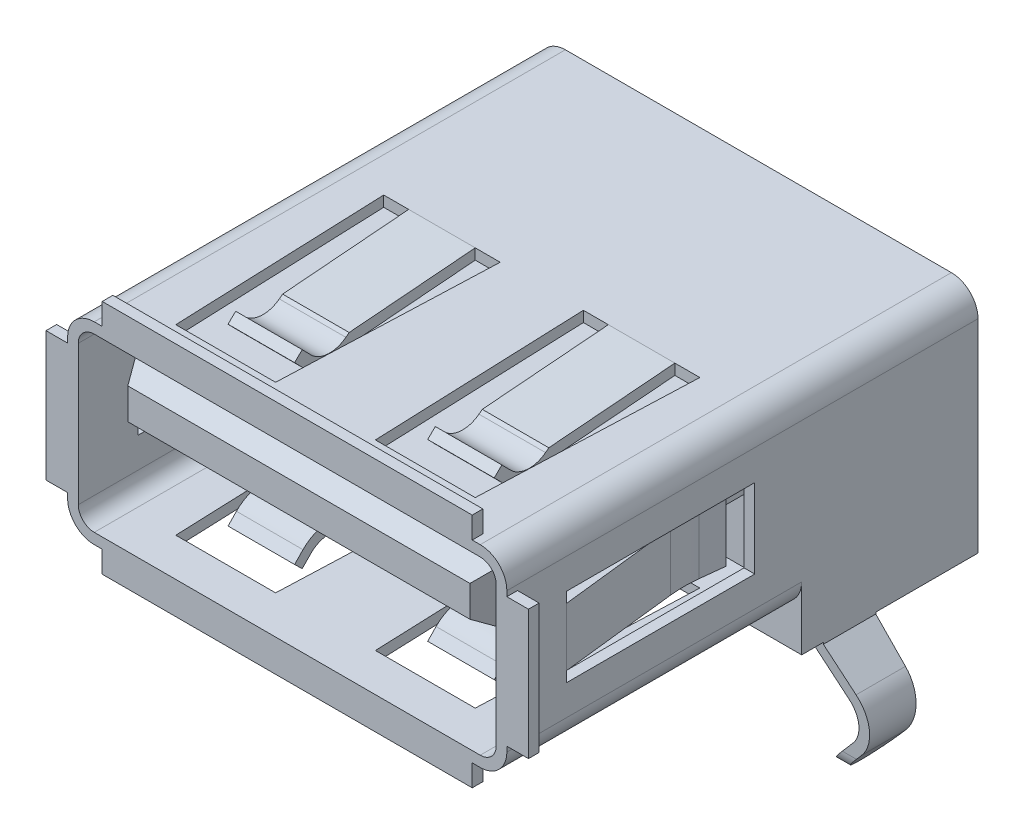
from build123d import *
from OCP.BRepFilletAPI import BRepFilletAPI_MakeChamfer

# Parameters (mm, degrees)
SKETCH1_W                       = 13.2
SKETCH1_H                       = 14.16
BASE_DEPTH                      = 5.8
SKETCH3_W                       = 11.12
SKETCH3_H                       = 0.65
SKETCH3_W_2                     = 0.65
SKETCH3_H_2                     = 3.89
FRONT_TABS_DEPTH                = 0.32
CORNER_FILLETS_R                = 0.8
CONTACT_AREA_CUTOUT_DEPTH       = 8.85
BACK_STEP_DEPTH                 = 5.3
SKETCH19_W                      = 2.4
SKETCH19_H                      = 3.1
BOTTOM_STEP_DEPTH               = 1.1
GROUND_TAIL_DEPTH               = 0.79
GROUND_TAIL_SHAPE_DEPTH         = 8
TOP_BOTTOM_FLANGE_CUTOUT_DEPTH  = 15.716534918
TOP_BOTTOM_FLANGE_DEPTH         = 1
TOP_BOTTOM_FLANGE_PATTERN_COUNT = 2
TOP_BOTTOM_FLANGE_PATTERN_PITCH = 6
SKETCH14_W                      = 5.65
SKETCH14_H                      = 2.38
SIDE_FLANGE_CUTOUT_DEPTH        = 18.377540102
SIDE_FLANGE_DEPTH               = 0.875
SKETCH16_W                      = 11.15
SKETCH16_H                      = 1.8
CONTACT_GUIDE_DEPTH             = 8.5
CONTACT_GUIDE_LEAD_IN_SIZE      = 0.75
CONTACT_GUIDE_LEAD_IN_SIZE2     = 0.433012702
CONTACT_1_DEPTH                 = 0.33
CONTACT_PATTERN2_COUNT          = 2
CONTACT_PATTERN2_PITCH          = 2.5
CONTACT_PATTERN3_COUNT          = 2
CONTACT_PATTERN3_PITCH          = 4.5
CONTACT_PATTERN4_COUNT          = 2
CONTACT_PATTERN4_PITCH          = 7
SKETCH20_W                      = 0.68
SKETCH20_H                      = 0.31
TAILS_DEPTH                     = 3.3


with BuildPart() as part:
    # Sketch1 → Base (new body)
    with BuildSketch(Plane(origin=(0, 0, 0), x_dir=(1, 0, 0), z_dir=(0, 1, 0))):
        Rectangle(SKETCH1_W, SKETCH1_H)
    extrude(amount=BASE_DEPTH)

    # Sketch3 → Front Tabs (add)
    with BuildSketch(Plane.XY.offset(7.08)):
        with Locations((0, 6.125)):
            Rectangle(SKETCH3_W, SKETCH3_H)
        with Locations((6.925, 2.9)):
            Rectangle(SKETCH3_W_2, SKETCH3_H_2)
        with Locations((0, -0.325)):
            Rectangle(SKETCH3_W, SKETCH3_H)
        with Locations((-6.925, 2.9)):
            Rectangle(SKETCH3_W_2, SKETCH3_H_2)
    extrude(amount=-FRONT_TABS_DEPTH)

    # Corner Fillets
    corner_fillets_edges = [part.edges().sort_by_distance(p)[0] for p in [
        (-6.6, 5.8, 0),
        (-6.6, 0, 0),
        (6.6, 0, 0),
        (6.6, 5.8, 0),
    ]]
    fillet(corner_fillets_edges, radius=CORNER_FILLETS_R)

    # Sketch8 → Contact Area Cutout (cut)
    with BuildSketch(Plane.XY.offset(7.08)):
        with BuildLine():
            Line((-6.28, 5), (-6.28, 0.8))
            ThreePointArc((-6.28, 0.8), (-6.139411255, 0.460588745), (-5.8, 0.32))
            Line((-5.8, 0.32), (5.8, 0.32))
            ThreePointArc((5.8, 0.32), (6.139411255, 0.460588745), (6.28, 0.8))
            Line((6.28, 0.8), (6.28, 5))
            ThreePointArc((6.28, 5), (6.139411255, 5.339411255), (5.8, 5.48))
            Line((5.8, 5.48), (-5.8, 5.48))
            ThreePointArc((-5.8, 5.48), (-6.139411255, 5.339411255), (-6.28, 5))
        make_face()
    extrude(amount=-CONTACT_AREA_CUTOUT_DEPTH, mode=Mode.SUBTRACT)

    # Sketch18 → Back Step (add)
    with BuildSketch(Plane(origin=(0, 0, -7.08), x_dir=(-1, 0, 0), z_dir=(0, 0, -1))):
        with BuildLine():
            Line((-6.6, 0.8), (-6.6, -1.1))
            Line((-6.6, -1.1), (6.6, -1.1))
            Line((6.6, -1.1), (6.6, 0.8))
            ThreePointArc((6.6, 0.8), (6.365685425, 0.234314575), (5.8, 0))
            Line((5.8, 0), (-5.8, 0))
            ThreePointArc((-5.8, 0), (-6.365685425, 0.234314575), (-6.6, 0.8))
        make_face()
    extrude(amount=-BACK_STEP_DEPTH)

    # Sketch19 → Bottom Step (add)
    with BuildSketch(Plane.XZ):
        with Locations((0, -0.23)):
            Rectangle(SKETCH19_W, SKETCH19_H)
    extrude(amount=BOTTOM_STEP_DEPTH)

    # Sketch10 → Ground Tail (add, symmetric)
    with BuildSketch(Plane.XY.offset(-3.22)):
        with BuildLine():
            Line((6.6, -1.15), (6.6, -1.1))
            Line((6.6, -1.1), (6.28, -1.1))
            Line((6.28, -1.1), (6.28, -1.28965545))
            Line((6.28, -1.28965545), (7.319978774, -2.254199461))
            ThreePointArc((7.319978774, -2.254199461), (7.578832958, -2.806464642), (7.380555001, -3.383255914))
            Line((7.380555001, -3.383255914), (6.505, -4.390006458))
            Line((6.505, -4.390006458), (6.746459546, -4.6))
            Line((6.746459546, -4.6), (7.622014547, -3.593249456))
            ThreePointArc((7.622014547, -3.593249456), (7.898373383, -2.789320634), (7.537583701, -2.019576155))
            Line((7.537583701, -2.019576155), (6.6, -1.15))
        make_face()
        with BuildLine():
            Line((-6.746459546, -4.6), (-6.505, -4.390006458))
            Line((-6.505, -4.390006458), (-7.380555001, -3.383255914))
            ThreePointArc((-7.380555001, -3.383255914), (-7.578832958, -2.806464642), (-7.319978774, -2.254199461))
            Line((-7.319978774, -2.254199461), (-6.28, -1.28965545))
            Line((-6.28, -1.28965545), (-6.28, -1.1))
            Line((-6.28, -1.1), (-6.6, -1.1))
            Line((-6.6, -1.1), (-6.6, -1.15))
            Line((-6.6, -1.15), (-7.537583701, -2.019576155))
            ThreePointArc((-7.537583701, -2.019576155), (-7.898373383, -2.789320634), (-7.622014547, -3.593249456))
            Line((-7.622014547, -3.593249456), (-6.746459546, -4.6))
        make_face()
    extrude(amount=GROUND_TAIL_DEPTH, both=True)

    # Sketch11 → Ground Tail Shape (cut, symmetric)
    with BuildSketch(Plane(origin=(0, 0, 0), x_dir=(0, 0, -1), z_dir=(1, 0, 0))):
        with BuildLine():
            Line((2.43, -1.1), (2.570893678, -3.784073205))
            ThreePointArc((2.570893678, -3.784073205), (2.772589441, -4.221512239), (3.22, -4.4))
            ThreePointArc((3.22, -4.4), (3.667410559, -4.221512239), (3.869106322, -3.784073205))
            Line((3.869106322, -3.784073205), (4.01, -1.1))
            Line((4.01, -1.1), (4.01, -4.7))
            Line((4.01, -4.7), (2.43, -4.7))
            Line((2.43, -4.7), (2.43, -1.1))
        make_face()
    extrude(amount=GROUND_TAIL_SHAPE_DEPTH, both=True, mode=Mode.SUBTRACT)

    # Sketch12 → Top/Bottom Flange Cutout (cut, through all)
    with BuildSketch(Plane(origin=(0, 5.8, 0), x_dir=(-1, 0, 0), z_dir=(0, 1, 0))):
        Polygon((4.5, 5.93), (4.75, -0.57), (1.25, -0.57), (1.5, 5.93), align=None)
        Polygon((-4.75, -0.57), (-1.25, -0.57), (-1.5, 5.93), (-4.5, 5.93), align=None)
    extrude(amount=-TOP_BOTTOM_FLANGE_CUTOUT_DEPTH, mode=Mode.SUBTRACT)

    # Sketch13 → Top/Bottom Flange (add, symmetric)
    with BuildSketch(Plane(origin=(-3, 0, 0), x_dir=(0, 0, -1), z_dir=(1, 0, 0))):
        with BuildLine():
            Line((0.57, 5.8), (-3.219077045, 5.491150763))
            Line((-3.219077045, 5.491150763), (-3.318256378, 5.415113674))
            ThreePointArc((-3.318256378, 5.415113674), (-3.86239675, 5.252061648), (-4.377598873, 5.491313566))
            Line((-4.377598873, 5.491313566), (-4.63, 5.75))
            Line((-4.63, 5.75), (-4.859039549, 5.526525427))
            Line((-4.859039549, 5.526525427), (-4.606638422, 5.267838993))
            ThreePointArc((-4.606638422, 5.267838993), (-3.88535545, 4.932886308), (-3.12355893, 5.161159144))
            Line((-3.12355893, 5.161159144), (-3.099161332, 5.179863871))
            Line((-3.099161332, 5.179863871), (0.57, 5.478938728))
            Line((0.57, 5.478938728), (0.57, 5.8))
        make_face()
        with BuildLine():
            Line((0.57, 0), (0.57, 0.321061272))
            Line((0.57, 0.321061272), (-3.099161332, 0.620136129))
            Line((-3.099161332, 0.620136129), (-3.12355893, 0.638840856))
            ThreePointArc((-3.12355893, 0.638840856), (-3.88535545, 0.867113692), (-4.606638422, 0.532161007))
            Line((-4.606638422, 0.532161007), (-4.859039549, 0.273474573))
            Line((-4.859039549, 0.273474573), (-4.63, 0.05))
            Line((-4.63, 0.05), (-4.377598873, 0.308686434))
            ThreePointArc((-4.377598873, 0.308686434), (-3.86239675, 0.547938352), (-3.318256378, 0.384886326))
            Line((-3.318256378, 0.384886326), (-3.219077045, 0.308849237))
            Line((-3.219077045, 0.308849237), (0.57, 0))
        make_face()
    top_bottom_flange = extrude(amount=TOP_BOTTOM_FLANGE_DEPTH, both=True)

    # Top/Bottom Flange Pattern: Top/Bottom Flange ×2
    with Locations(*[(i * TOP_BOTTOM_FLANGE_PATTERN_PITCH, 0, 0) for i in range(1, TOP_BOTTOM_FLANGE_PATTERN_COUNT)]):
        add(top_bottom_flange)

    # Sketch14 → Side Flange Cutout (cut, through all)
    with BuildSketch(Plane(origin=(6.6, 0, 0), x_dir=(0, 0, -1), z_dir=(1, 0, 0))):
        with Locations((-2.455, 2.9)):
            Rectangle(SKETCH14_W, SKETCH14_H)
    extrude(amount=-SIDE_FLANGE_CUTOUT_DEPTH, mode=Mode.SUBTRACT)

    # Sketch15 → Side Flange (add, symmetric)
    with BuildSketch(Plane(origin=(0, 2.9, 0), x_dir=(-1, 0, 0), z_dir=(0, 1, 0))):
        with BuildLine():
            Line((6.6, 5.28), (6.199012428, 1.753694006))
            ThreePointArc((6.199012428, 1.753694006), (6.175000079, 1.330770202), (6.198838699, 0.90783657))
            Line((6.198838699, 0.90783657), (6.281300503, 0.18))
            Line((6.281300503, 0.18), (5.963334739, 0.143975387))
            Line((5.963334739, 0.143975387), (5.880872935, 0.871811958))
            ThreePointArc((5.880872935, 0.871811958), (5.855000086, 1.330835926), (5.881061488, 1.789849227))
            Line((5.881061488, 1.789849227), (6.28204906, 5.316155222))
            Line((6.28204906, 5.316155222), (6.6, 5.28))
        make_face()
        with BuildLine():
            Line((-5.963334739, 0.143975387), (-6.281300503, 0.18))
            Line((-6.281300503, 0.18), (-6.198838699, 0.90783657))
            ThreePointArc((-6.198838699, 0.90783657), (-6.175000079, 1.330770202), (-6.199012428, 1.753694006))
            Line((-6.199012428, 1.753694006), (-6.6, 5.28))
            Line((-6.6, 5.28), (-6.28204906, 5.316155222))
            Line((-6.28204906, 5.316155222), (-5.881061488, 1.789849227))
            ThreePointArc((-5.881061488, 1.789849227), (-5.855000086, 1.330835926), (-5.880872935, 0.871811958))
            Line((-5.880872935, 0.871811958), (-5.963334739, 0.143975387))
        make_face()
    extrude(amount=SIDE_FLANGE_DEPTH, both=True)

    # Sketch16 → Contact Guide (add)
    with BuildSketch(Plane.XY.offset(-1.77)):
        with Locations((0, 3.82)):
            Rectangle(SKETCH16_W, SKETCH16_H)
    extrude(amount=CONTACT_GUIDE_DEPTH)

    # Contact Guide Lead-in: one chamfer whose edges measure the first distance from different faces: ONE call of the kernel's chamfer builder (chamfer() names one face for all edges)
    contact_guide_lead_in_edges_1 = [part.edges().sort_by_distance(p)[0] for p in [
        (5.575, 3.82, 6.73),
    ]]
    contact_guide_lead_in_side_1 = [part.faces().sort_by_distance(p)[0] for p in [
        (5.575, 3.82, 2.48),
    ]]
    contact_guide_lead_in_edges_2 = [part.edges().sort_by_distance(p)[0] for p in [
        (0, 4.72, 6.73),
    ]]
    contact_guide_lead_in_side_2 = [part.faces().sort_by_distance(p)[0] for p in [
        (0, 4.72, 2.48),
    ]]
    contact_guide_lead_in_edges_3 = [part.edges().sort_by_distance(p)[0] for p in [
        (-5.575, 3.82, 6.73),
    ]]
    contact_guide_lead_in_side_3 = [part.faces().sort_by_distance(p)[0] for p in [
        (-5.575, 3.82, 2.48),
    ]]
    contact_guide_lead_in_edges_4 = [part.edges().sort_by_distance(p)[0] for p in [
        (0, 2.92, 6.73),
    ]]
    contact_guide_lead_in_side_4 = [part.faces().sort_by_distance(p)[0] for p in [
        (0, 2.92, 2.48),
    ]]
    contact_guide_lead_in = BRepFilletAPI_MakeChamfer(part.part.solid().wrapped)
    for e in contact_guide_lead_in_edges_1:
        contact_guide_lead_in.Add(CONTACT_GUIDE_LEAD_IN_SIZE, CONTACT_GUIDE_LEAD_IN_SIZE2, e.wrapped, contact_guide_lead_in_side_1[0].wrapped)  # the first distance lies on this face
    for e in contact_guide_lead_in_edges_2:
        contact_guide_lead_in.Add(CONTACT_GUIDE_LEAD_IN_SIZE, CONTACT_GUIDE_LEAD_IN_SIZE2, e.wrapped, contact_guide_lead_in_side_2[0].wrapped)  # the first distance lies on this face
    for e in contact_guide_lead_in_edges_3:
        contact_guide_lead_in.Add(CONTACT_GUIDE_LEAD_IN_SIZE, CONTACT_GUIDE_LEAD_IN_SIZE2, e.wrapped, contact_guide_lead_in_side_3[0].wrapped)  # the first distance lies on this face
    for e in contact_guide_lead_in_edges_4:
        contact_guide_lead_in.Add(CONTACT_GUIDE_LEAD_IN_SIZE, CONTACT_GUIDE_LEAD_IN_SIZE2, e.wrapped, contact_guide_lead_in_side_4[0].wrapped)  # the first distance lies on this face
    add(Compound.cast(contact_guide_lead_in.Shape()), mode=Mode.REPLACE)

    # Sketch17 → Contact 1 (add, symmetric)
    with BuildSketch(Plane(origin=(-3.5, 0, 0), x_dir=(0, 0, -1), z_dir=(1, 0, 0))):
        with BuildLine():
            Line((1.77, 3.91), (1.77, 3.65))
            Line((1.77, 3.65), (0.52, 3.65))
            Line((0.52, 3.65), (-3.042949724, 2.507463672))
            ThreePointArc((-3.042949724, 2.507463672), (-4.022552697, 2.419100424), (-4.946249642, 2.757056047))
            Line((-4.946249642, 2.757056047), (-5.48, 3.1))
            Line((-5.48, 3.1), (-5.339455597, 3.31874019))
            Line((-5.339455597, 3.31874019), (-4.805705239, 2.975796237))
            ThreePointArc((-4.805705239, 2.975796237), (-3.988746608, 2.676893264), (-3.122342201, 2.755045647))
            Line((-3.122342201, 2.755045647), (0.479332591, 3.91))
            Line((0.479332591, 3.91), (1.77, 3.91))
        make_face()
    contact_1 = extrude(amount=CONTACT_1_DEPTH, both=True)

    # Contact Pattern2: Contact 1 ×2
    with Locations(*[(i * CONTACT_PATTERN2_PITCH, 0, 0) for i in range(1, CONTACT_PATTERN2_COUNT)]):
        add(contact_1)

    # Contact Pattern3: Contact 1 ×2
    with Locations(*[(i * CONTACT_PATTERN3_PITCH, 0, 0) for i in range(1, CONTACT_PATTERN3_COUNT)]):
        add(contact_1)

    # Contact Pattern4: Contact 1 ×2
    with Locations(*[(i * CONTACT_PATTERN4_PITCH, 0, 0) for i in range(1, CONTACT_PATTERN4_COUNT)]):
        add(contact_1)

    # Sketch20 → Tails (add)
    with BuildSketch(Plane.XZ.offset(1.1)):
        with Locations((-3.5, -5.97)):
            Rectangle(SKETCH20_W, SKETCH20_H)
        with Locations((3.5, -5.97)):
            Rectangle(SKETCH20_W, SKETCH20_H)
        with Locations((-1, -5.97)):
            Rectangle(SKETCH20_W, SKETCH20_H)
        with Locations((1, -5.97)):
            Rectangle(SKETCH20_W, SKETCH20_H)
    extrude(amount=TAILS_DEPTH)


solid = part.part
